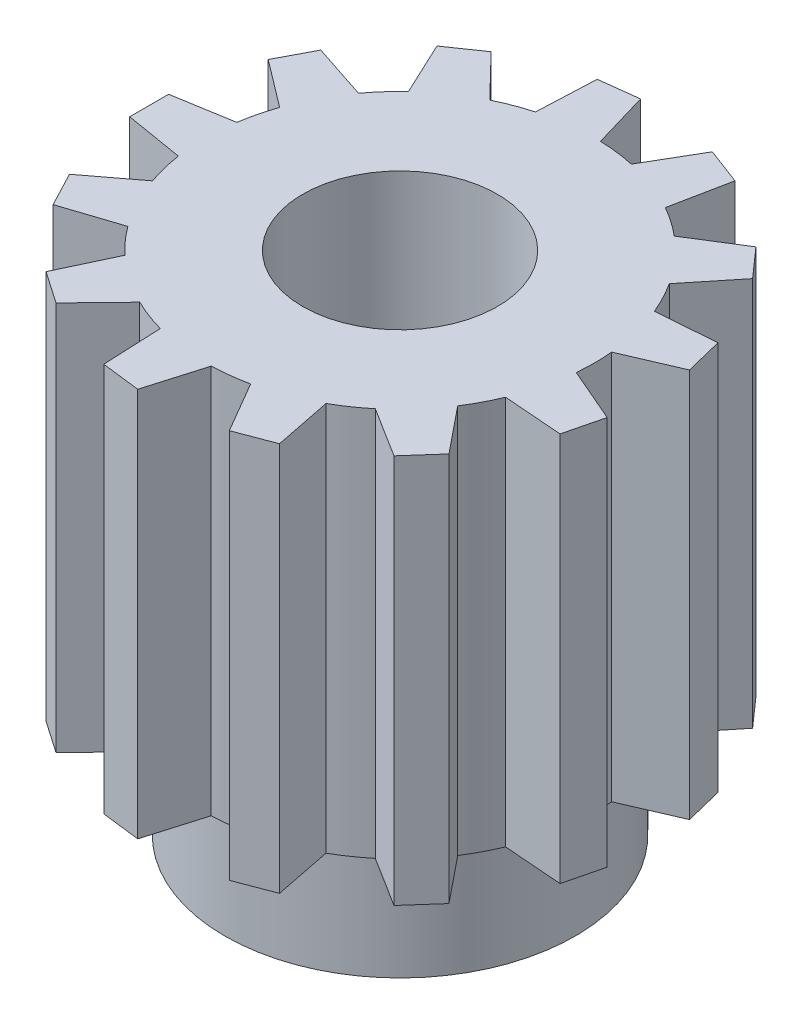
from build123d import *

# Parameters (mm, degrees)
SKETCH1_R           = 4.5
SKETCH1_R_2         = 2.5
BOSS_EXTRUDE1_DEPTH = 3
SKETCH2_R           = 5
SKETCH2_R_2         = 2.5
BOSS_EXTRUDE2_DEPTH = 10
BOSS_EXTRUDE3_DEPTH = 10


with BuildPart() as part:
    # Sketch1 → Boss-Extrude1 (new body)
    with BuildSketch(Plane(origin=(0, 0, 0), x_dir=(1, 0, 0), z_dir=(0, 1, 0))):
        with Locations(Location((0, 0, 0), (0, 0, 270))):
            Circle(SKETCH1_R)
        with Locations(Location((0, 0, 0), (0, 0, 270))):
            Circle(SKETCH1_R_2, mode=Mode.SUBTRACT)
    extrude(amount=BOSS_EXTRUDE1_DEPTH)

    # Sketch2 → Boss-Extrude2 (add)
    with BuildSketch(Plane(origin=(0, 3, 0), x_dir=(1, 0, 0), z_dir=(0, 1, 0))):
        with Locations(Location((0, 0, 0), (0, 0, 270))):
            Circle(SKETCH2_R)
        with Locations(Location((0, 0, 0), (0, 0, 270))):
            Circle(SKETCH2_R_2, mode=Mode.SUBTRACT)
    extrude(amount=BOSS_EXTRUDE2_DEPTH)

    # Sketch3 → Boss-Extrude3 (add)
    with BuildSketch(Plane(origin=(0, 13, 0), x_dir=(1, 0, 0), z_dir=(0, 1, 0))):
        Polygon((-4.943429983, -0.75), (-4.943429983, 0.75), (-6.443429983, 0.5), (-6.443429983, -0.5), align=None)
        Polygon((-5.473012319, 3.437139234), (-4.028647487, 2.961418482), (-4.725732245, 1.633234443), (-5.937735491, 2.551683208), align=None)
        Polygon((-3.248793489, 5.586871291), (-2.190950402, 4.494411678), (-3.425426201, 3.642314558), (-4.071777355, 5.018806544), align=None)
        Polygon((-0.280315223, 6.456718464), (0.148667016, 4.997789323), (-1.340396295, 4.816984303), (-1.273024097, 6.336181784), align=None)
        Polygon((2.752379883, 5.847409249), (2.454226613, 4.356233664), (1.051702249, 4.888140994), (1.81736364, 6.202014137), align=None)
        Polygon((5.154537927, 3.898529045), (4.197552469, 2.71671737), (3.202868482, 3.839483492), (4.491415268, 4.647039793), align=None)
        Polygon((6.375853451, 1.056542818), (4.979269641, 0.454833867), (4.620296144, 1.911246593), (6.136537786, 2.027484635), align=None)
        Polygon((6.136537786, -2.027484635), (4.620296144, -1.911246593), (4.979269641, -0.454833867), (6.375853451, -1.056542818), align=None)
        Polygon((4.491415268, -4.647039793), (3.202868482, -3.839483492), (4.197552469, -2.71671737), (5.154537927, -3.898529045), align=None)
        Polygon((1.81736364, -6.202014137), (1.051702249, -4.888140994), (2.454226613, -4.356233664), (2.752379883, -5.847409249), align=None)
        Polygon((-1.273024097, -6.336181784), (-1.340396295, -4.816984303), (0.148667016, -4.997789323), (-0.280315223, -6.456718464), align=None)
        Polygon((-4.071777355, -5.018806544), (-3.425426201, -3.642314558), (-2.190950402, -4.494411678), (-3.248793489, -5.586871291), align=None)
        Polygon((-5.937735491, -2.551683208), (-4.725732245, -1.633234443), (-4.028647487, -2.961418482), (-5.473012319, -3.437139234), align=None)
    extrude(amount=-BOSS_EXTRUDE3_DEPTH)


solid = part.part
